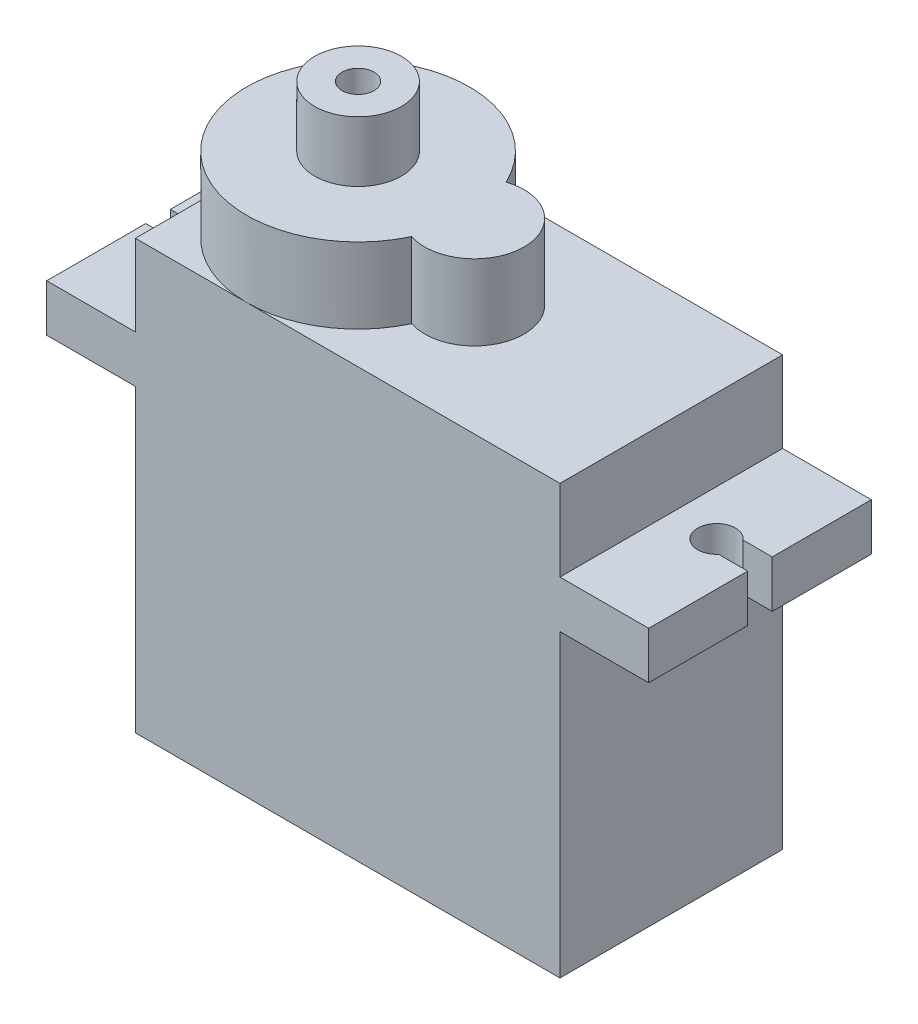
from build123d import *

# Parameters (mm, degrees)
ESBO_O1_W                  = 22.5
ESBO_O1_H                  = 11.8
RESSALTO_EXTRUS_O1_DEPTH   = 22.7
ESBO_O2_W                  = 11.8
ESBO_O2_H                  = 2.5
RESSALTO_EXTRUS_O2_DEPTH   = 4.7
RESSALTO_EXTRUS_O3_DEPTH   = 4.7
RESSALTO_EXTRUS_O4_DEPTH   = 4
ESBO_O5_R                  = 2.3
ESBO_O5_R_2                = 0.85
RESSALTO_EXTRUS_O5_DEPTH   = 3.2
CORTE_EXTRUS_O1_DEPTH      = 35.894698738
CORTE_EXTRUS_O1_DEPTH_BACK = 3.2
CORTE_EXTRUS_O2_DEPTH      = 35.894698738
CORTE_EXTRUS_O2_DEPTH_BACK = 3.2


with BuildPart() as part:
    # Esboço1 → Ressalto-extrusão1 (new body)
    with BuildSketch(Plane(origin=(0, 0, 0), x_dir=(1, 0, 0), z_dir=(0, 1, 0))):
        with Locations((11.25, 5.9)):
            Rectangle(ESBO_O1_W, ESBO_O1_H)
    extrude(amount=RESSALTO_EXTRUS_O1_DEPTH)

    # Esboço2 → Ressalto-extrusão2 (add)
    with BuildSketch(Plane.ZY):
        with Locations((-5.9, 17.15)):
            Rectangle(ESBO_O2_W, ESBO_O2_H)
    extrude(amount=RESSALTO_EXTRUS_O2_DEPTH)

    # Esboço3 → Ressalto-extrusão3 (add)
    with BuildSketch(Plane(origin=(22.5, 0, 0), x_dir=(0, 0, -1), z_dir=(1, 0, 0))):
        Polygon((5.9, 15.9), (11.8, 15.9), (11.8, 18.4), (0, 18.4), (0, 15.9), align=None)
    extrude(amount=RESSALTO_EXTRUS_O3_DEPTH)

    # Esboço4 → Ressalto-extrusão4 (add)
    with BuildSketch(Plane(origin=(0, 22.7, 0), x_dir=(1, 0, 0), z_dir=(0, 1, 0))):
        with BuildLine():
            ThreePointArc((11.244155686, 8.4), (0, 5.9), (11.244155686, 3.4))
            ThreePointArc((11.244155686, 3.4), (14.7, 5.9), (11.244155686, 8.4))
        make_face()
    extrude(amount=RESSALTO_EXTRUS_O4_DEPTH)

    # Esboço5 → Ressalto-extrusão5 (add)
    with BuildSketch(Plane(origin=(0, 26.7, 0), x_dir=(1, 0, 0), z_dir=(0, 1, 0))):
        with Locations(Location((5.9, 5.9, 0), (0, 0, 90))):
            Circle(ESBO_O5_R)
        with Locations(Location((5.9, 5.9, 0), (0, 0, 270))):
            Circle(ESBO_O5_R_2, mode=Mode.SUBTRACT)
    extrude(amount=RESSALTO_EXTRUS_O5_DEPTH)

    # Esboço6 → Corte-extrusão1 (cut, two sides: drawn at the far end of the back side and taken through both)
    with BuildSketch(Plane(origin=(0, 18.4, 0), x_dir=(1, 0, 0), z_dir=(0, 1, 0)).offset(-CORTE_EXTRUS_O1_DEPTH_BACK)):
        with BuildLine():
            Line((-3.159934208, 6.55), (-4.7, 6.55))
            Line((-4.7, 6.55), (-4.7, 5.25))
            Line((-4.7, 5.25), (-3.159934208, 5.25))
            ThreePointArc((-3.159934208, 5.25), (-1.4, 5.9), (-3.159934208, 6.55))
        make_face()
    extrude(amount=CORTE_EXTRUS_O1_DEPTH + CORTE_EXTRUS_O1_DEPTH_BACK, mode=Mode.SUBTRACT)

    # Esboço7 → Corte-extrusão2 (cut, two sides: drawn at the far end of the back side and taken through both)
    with BuildSketch(Plane(origin=(0, 18.4, 0), x_dir=(1, 0, 0), z_dir=(0, 1, 0)).offset(-CORTE_EXTRUS_O2_DEPTH_BACK)):
        with BuildLine():
            Line((25.659934208, 5.25), (27.2, 5.25))
            Line((27.2, 5.25), (27.2, 6.55))
            Line((27.2, 6.55), (25.659934208, 6.55))
            ThreePointArc((25.659934208, 6.55), (23.9, 5.9), (25.659934208, 5.25))
        make_face()
    extrude(amount=CORTE_EXTRUS_O2_DEPTH + CORTE_EXTRUS_O2_DEPTH_BACK, mode=Mode.SUBTRACT)


solid = part.part
